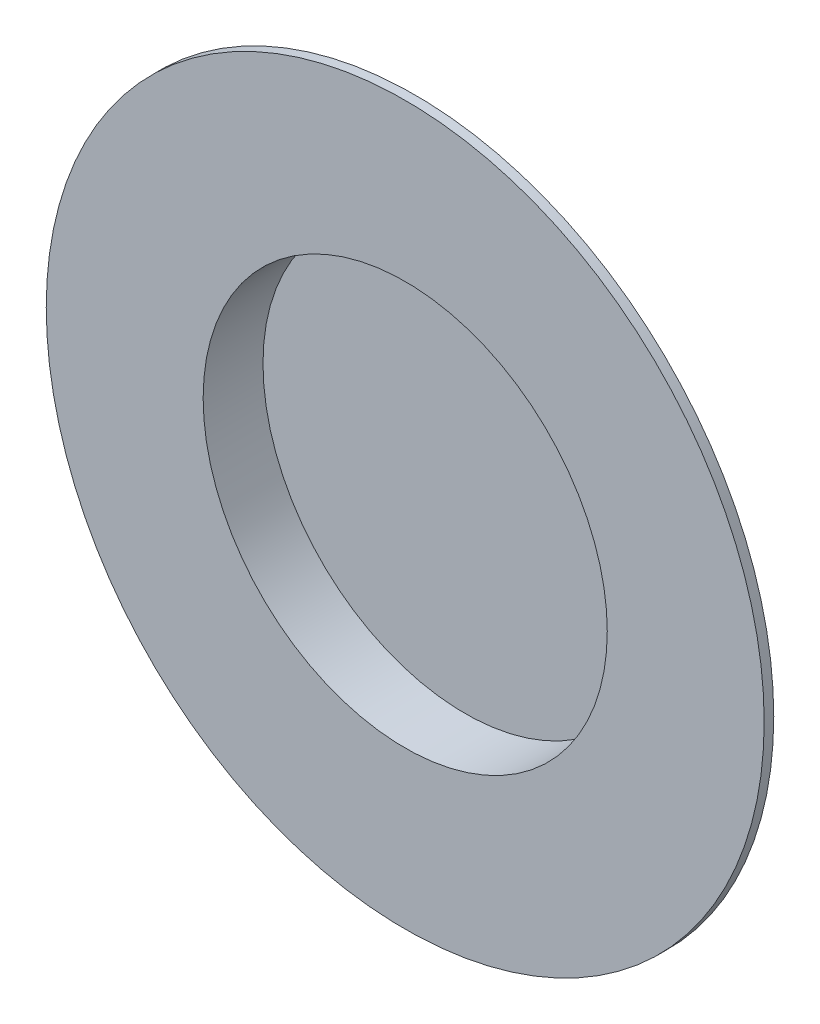
from build123d import *

# Parameters (mm, degrees)
SKETCH1_R           = 113.336684476
BOSS_EXTRUDE1_DEPTH = 2
SKETCH3_R           = 113.336684476
BOSS_EXTRUDE2_DEPTH = 33
BOSS_EXTRUDE2_DRAFT = -66
SKETCH4_R           = 187.455898015
BOSS_EXTRUDE3_DEPTH = 5
SKETCH6_W           = 105.518937327
SKETCH6_H           = 48.279891136
SKETCH7_R           = 25
CUT_EXTRUDE1_DEPTH  = 30.552152957


with BuildPart() as part:
    # Sketch1 → Boss-Extrude1 (new body)
    with BuildSketch(Plane.XY):
        with Locations((-74.414862174, -31.38339944)):
            Circle(SKETCH1_R)
    extrude(amount=BOSS_EXTRUDE1_DEPTH)


with BuildPart() as boss_extrude2_tool:
    # Sketch3 → Boss-Extrude2 (with draft: the straight prism first)
    with BuildSketch(Plane.XY.offset(2)):
        with Locations((-74.414862174, -31.38339944)):
            Circle(SKETCH3_R)
    extrude(amount=BOSS_EXTRUDE2_DEPTH)
    # Boss-Extrude2: the draft: its side faces are tilted about the plane it starts from
    boss_extrude2_sides = [boss_extrude2_tool.faces().sort_by_distance(p)[0] for p in [
        (-187.75154665, -31.38339944, 18.5),
    ]]
    draft(boss_extrude2_sides, Plane.XY.offset(2), BOSS_EXTRUDE2_DRAFT)


with BuildPart() as part_1:
    add(part.part)

    # Boss-Extrude2: add boss_extrude2_tool
    add(boss_extrude2_tool.part)

    # Sketch4 → Boss-Extrude3 (add)
    with BuildSketch(Plane.XY.offset(35)):
        with Locations((-74.414862174, -31.38339944)):
            Circle(SKETCH4_R)
    extrude(amount=BOSS_EXTRUDE3_DEPTH)

    # Sketch6 → Cut-Revolve1 (revolve, cut)
    with BuildSketch(Plane(origin=(0, -31.38339944, 0), x_dir=(-1, 0, 0), z_dir=(0, -1, 0))):
        with Locations((21.655393511, -32.895152959)):
            Rectangle(SKETCH6_W, SKETCH6_H)
    revolve(axis=Axis((-74.414862174, -31.38339944, -21.108642796), (0, 0, -1)), mode=Mode.SUBTRACT)

    # Sketch7 → Cut-Extrude1 (cut)
    with BuildSketch(Plane(origin=(0, 0, 0), x_dir=(-1, 0, 0), z_dir=(0, 0, -1))):
        with Locations((-74.30011683, -31.38339944)):
            Circle(SKETCH7_R)
        with Locations((74.414862174, -180.098378444)):
            Circle(SKETCH7_R)
        with Locations((74.414862174, 117.331579563)):
            Circle(SKETCH7_R)
        with Locations((223.129841177, -31.38339944)):
            Circle(SKETCH7_R)
    extrude(amount=-CUT_EXTRUDE1_DEPTH, mode=Mode.SUBTRACT)


solid = part_1.part
